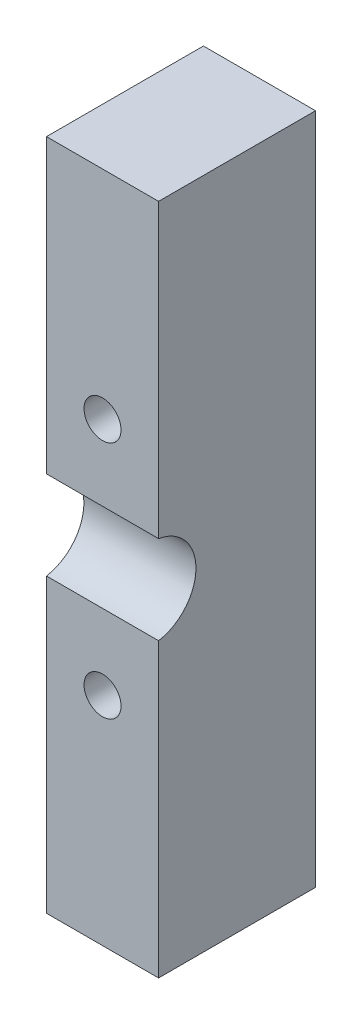
from build123d import *

# Parameters (mm, degrees)
SKETCH_1_W          = 70
SKETCH_1_H          = 90
EXTRUDE_1_DEPTH     = 10
SKETCH_2_W          = 15
SKETCH_2_H          = 90
EXTRUDE_2_DEPTH     = 12
EXTRUDE_3_DEPTH     = 3
EXTRUDE_4_DEPTH     = 3
CUT_EXTRUDE_1_REACH = 109.745
SKETCH_7_R          = 6
SKETCH_5_R          = 2.475
CUT_EXTRUDE_2_DEPTH = 22
SKETCH_6_R          = 1.975
CUT_EXTRUDE_4_DEPTH = 10
SKETCH_9_W          = 15
SKETCH_9_H          = 90
CUT_EXTRUDE_5_DEPTH = 1
SKETCH_11_W         = 55
SKETCH_11_H         = 90
CUT_EXTRUDE_6_DEPTH = 116.935326799


with BuildPart() as part:
    # 草图1 → 凸台-拉伸1 (new body)
    with BuildSketch(Plane.XY):
        with Locations((35, 45)):
            Rectangle(SKETCH_1_W, SKETCH_1_H)
    extrude(amount=EXTRUDE_1_DEPTH)

    # 草图2 → 凸台-拉伸2 (add)
    with BuildSketch(Plane.XY.offset(10)):
        with Locations((62.5, 45)):
            Rectangle(SKETCH_2_W, SKETCH_2_H)
    extrude(amount=EXTRUDE_2_DEPTH)

    # 草图3 → 凸台-拉伸3 (add)
    with BuildSketch(Plane(origin=(0, 90, 0), x_dir=(1, 0, 0), z_dir=(0, 1, 0))):
        Polygon((55, -10), (6, -10), (55, -21), align=None)
    extrude(amount=-EXTRUDE_3_DEPTH)

    # 草图4 → 凸台-拉伸4 (add)
    with BuildSketch(Plane.XZ):
        Polygon((55, 21), (6, 10), (55, 10), align=None)
    extrude(amount=-EXTRUDE_4_DEPTH)

    # 草图7 → 切除-拉伸1 (cut, up to next)
    with BuildSketch(Plane.ZY.offset(-55), mode=Mode.PRIVATE) as cut_extrude_1_sk1:
        with Locations((22, 45)):
            Circle(SKETCH_7_R)
    cut_extrude_1_tool1 = extrude(cut_extrude_1_sk1.sketch, amount=-CUT_EXTRUDE_1_REACH, mode=Mode.PRIVATE) & part.part
    add(cut_extrude_1_tool1.solids().sort_by_distance((55, 45, 22))[0], mode=Mode.SUBTRACT)

    # 草图5 → 切除-拉伸2 (cut)
    with BuildSketch(Plane.XY.offset(22)):
        with Locations((62.5, 61)):
            Circle(SKETCH_5_R)
        with Locations((62.5, 29)):
            Circle(SKETCH_5_R)
    extrude(amount=-CUT_EXTRUDE_2_DEPTH, mode=Mode.SUBTRACT)

    # 草图6 → 切除-拉伸4 (cut)
    with BuildSketch(Plane.XY.offset(10)):
        with Locations((3, 29)):
            Circle(SKETCH_6_R)
        with Locations((3, 61)):
            Circle(SKETCH_6_R)
    extrude(amount=-CUT_EXTRUDE_4_DEPTH, mode=Mode.SUBTRACT)

    # 草图9 → 切除-拉伸5 (cut)
    with BuildSketch(Plane.XY.offset(22)):
        with Locations((62.5, 45)):
            Rectangle(SKETCH_9_W, SKETCH_9_H)
    extrude(amount=-CUT_EXTRUDE_5_DEPTH, mode=Mode.SUBTRACT)

    # 草图11 → 切除-拉伸6 (cut, through all)
    with BuildSketch(Plane(origin=(0, 0, 0), x_dir=(-1, 0, 0), z_dir=(0, 0, -1))):
        with Locations((-27.5, 45)):
            Rectangle(SKETCH_11_W, SKETCH_11_H)
    extrude(amount=-CUT_EXTRUDE_6_DEPTH, mode=Mode.SUBTRACT)


solid = part.part
